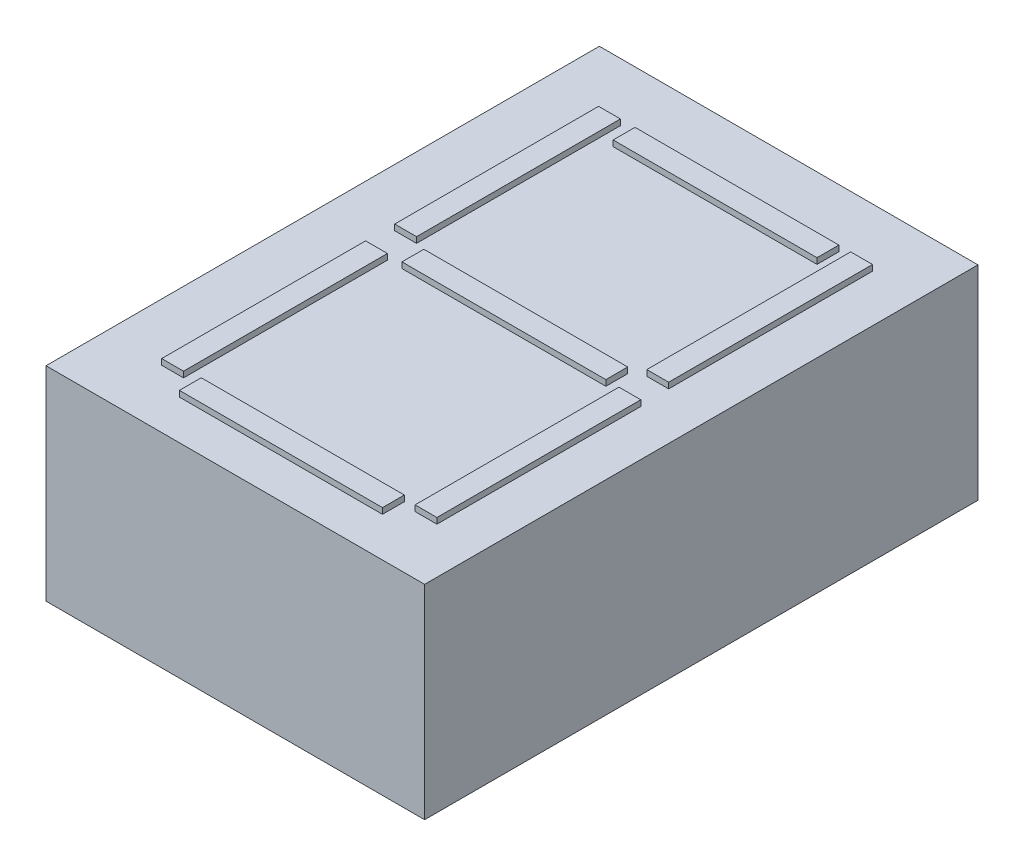
from build123d import *

# Parameters (mm, degrees)
SKETCH1_W           = 13
SKETCH1_H           = 19
BOSS_EXTRUDE1_DEPTH = 7
SKETCH2_W           = 7
SKETCH2_H           = 0.75
SKETCH2_W_2         = 0.75
SKETCH2_H_2         = 7
SKETCH2_W_3         = 6.972272669
BOSS_EXTRUDE2_DEPTH = 0.2


with BuildPart() as part:
    # Sketch1 → Boss-Extrude1 (new body)
    with BuildSketch(Plane(origin=(0, 0, 0), x_dir=(1, 0, 0), z_dir=(0, 1, 0))):
        with Locations((6.5, -9.363530646)):
            Rectangle(SKETCH1_W, SKETCH1_H)
    extrude(amount=BOSS_EXTRUDE1_DEPTH)

    # Sketch2 → Boss-Extrude2 (add)
    with BuildSketch(Plane(origin=(0, 7, 0), x_dir=(1, 0, 0), z_dir=(0, 1, 0))):
        with Locations((6.722702143, -2.238530646)):
            Rectangle(SKETCH2_W, SKETCH2_H)
        with Locations((2.347702143, -5.363530646)):
            Rectangle(SKETCH2_W_2, SKETCH2_H_2)
        with Locations((11.003251179, -5.363530646)):
            Rectangle(SKETCH2_W_2, SKETCH2_H_2)
        with Locations((6.722702143, -9.488530646)):
            Rectangle(SKETCH2_W, SKETCH2_H)
        with Locations((2.347702143, -13.363530646)):
            Rectangle(SKETCH2_W_2, SKETCH2_H_2)
        with Locations((6.708838478, -17.130647723)):
            Rectangle(SKETCH2_W_3, SKETCH2_H)
        with Locations((11.047702143, -13.363530646)):
            Rectangle(SKETCH2_W_2, SKETCH2_H_2)
    extrude(amount=BOSS_EXTRUDE2_DEPTH)


solid = part.part
